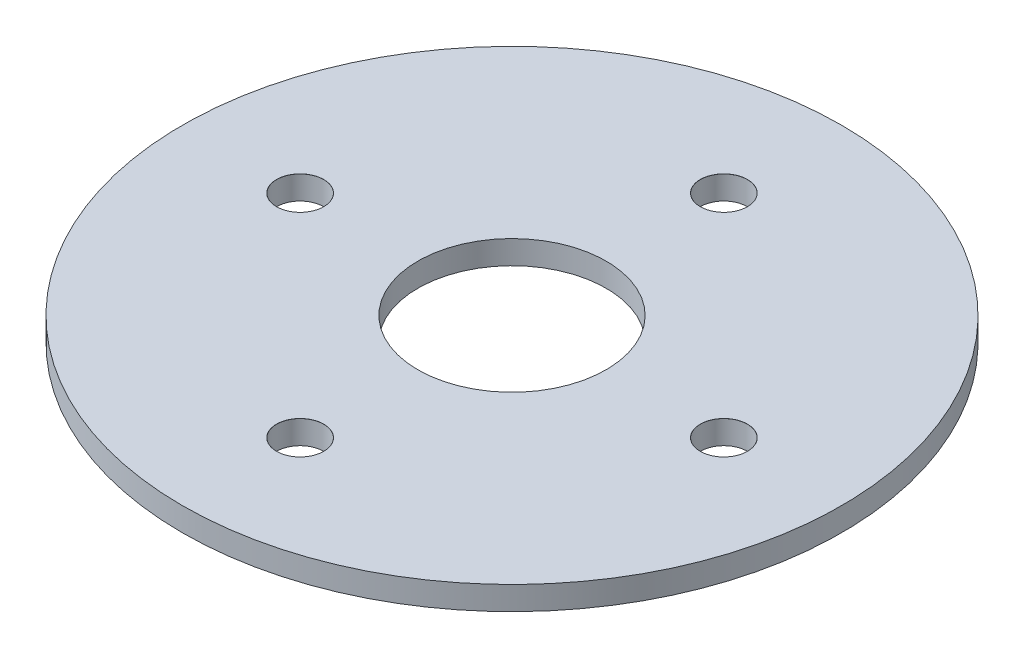
from build123d import *

# Parameters (mm, degrees)
SKETCH_1_R                       = 140
SKETCH_1_R_2                     = 40
EXTRUDE_1_DEPTH                  = 10
HOLE_WIZARD_20_0_20_1_AT_2_COUNT = 2
HOLE_WIZARD_20_0_20_1_AT_2_PITCH = 127.279220614
HOLE_WIZARD_20_0_20_1_AT_3_COUNT = 2
HOLE_WIZARD_20_0_20_1_AT_3_PITCH = 180
HOLE_WIZARD_20_0_20_1_AT_4_COUNT = 2
HOLE_WIZARD_20_0_20_1_AT_4_PITCH = 127.279220614


with BuildPart() as part:
    # 草图1 → 凸台-拉伸1 (new body)
    with BuildSketch(Plane(origin=(0, 0, 0), x_dir=(1, 0, 0), z_dir=(0, 1, 0))):
        Circle(SKETCH_1_R)
        Circle(SKETCH_1_R_2, mode=Mode.SUBTRACT)
    extrude(amount=EXTRUDE_1_DEPTH)

    # 草图3 → Ø20.0 (20) 直径孔1 (revolve, cut)
    with BuildSketch(Plane(origin=(0, 10, 90), x_dir=(0, 0, 1), z_dir=(1, 0, 0))):
        Polygon((0, 0), (0, 10), (10, 10), (10, 0.025), (10.025, 0), align=None)
    hole_wizard_20_0_20_1 = revolve(axis=Axis((0, 16.35, 90), (0, -1, 0)), mode=Mode.SUBTRACT)

    # Ø20.0 (20) 直径孔1 at 2: Ø20.0 (20) 直径孔1 ×2
    with Locations(*[Vector(0.7071067811865476, 0, -0.7071067811865476) * (i * HOLE_WIZARD_20_0_20_1_AT_2_PITCH) for i in range(1, HOLE_WIZARD_20_0_20_1_AT_2_COUNT)]):
        add(hole_wizard_20_0_20_1, mode=Mode.SUBTRACT)

    # Ø20.0 (20) 直径孔1 at 3: Ø20.0 (20) 直径孔1 ×2
    with Locations(*[(0, 0, -i * HOLE_WIZARD_20_0_20_1_AT_3_PITCH) for i in range(1, HOLE_WIZARD_20_0_20_1_AT_3_COUNT)]):
        add(hole_wizard_20_0_20_1, mode=Mode.SUBTRACT)

    # Ø20.0 (20) 直径孔1 at 4: Ø20.0 (20) 直径孔1 ×2
    with Locations(*[Vector(-0.7071067811865476, 0, -0.7071067811865476) * (i * HOLE_WIZARD_20_0_20_1_AT_4_PITCH) for i in range(1, HOLE_WIZARD_20_0_20_1_AT_4_COUNT)]):
        add(hole_wizard_20_0_20_1, mode=Mode.SUBTRACT)


solid = part.part
